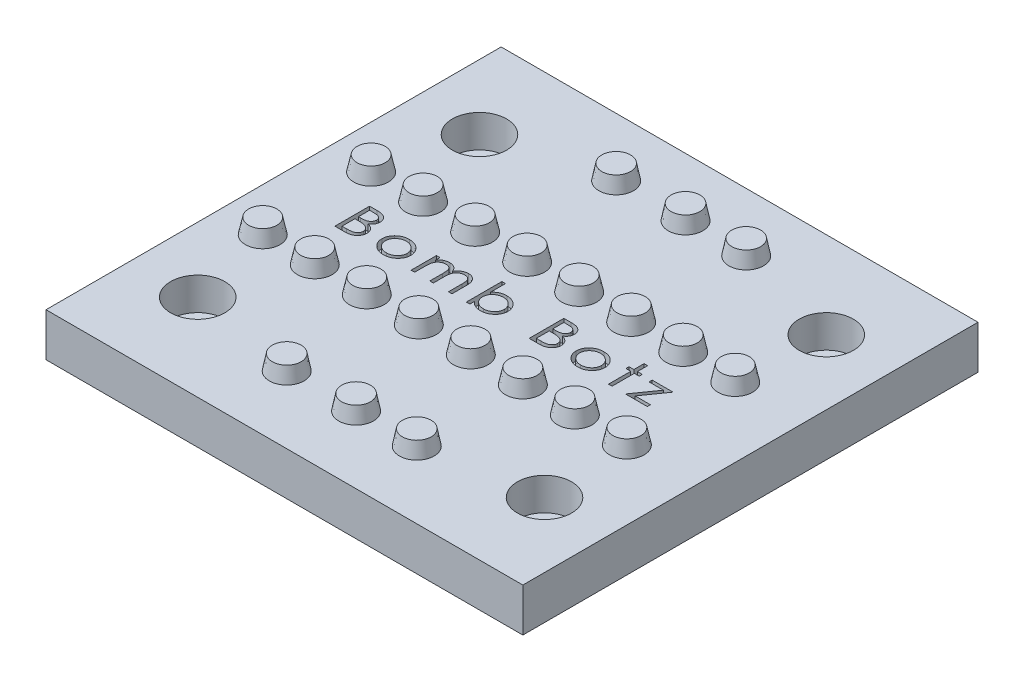
from build123d import *

# Parameters (mm, degrees)
SKETCH3_W                     = 69.85
SKETCH3_H                     = 66.675
BOSS_EXTRUDE2_DEPTH           = 6.35
SKETCH5_R                     = 3.96875
CUT_EXTRUDE1_DEPTH            = 4.7625
SKETCH6_R                     = 2.54
CUT_EXTRUDE2_DEPTH            = 71.380467635
SKETCH7_R                     = 2.54
BOSS_EXTRUDE3_DEPTH           = 2.2225
BOSS_EXTRUDE3_DRAFT           = 12
BOSS_EXTRUDE3_PROFILE_2_DEPTH = 2.2225
BOSS_EXTRUDE3_PROFILE_2_DRAFT = 12
LPATTERN1_COPY_1_SKETCH_R     = 2.54
LPATTERN1_COPY_1_DEPTH        = 2.2225
LPATTERN1_COPY_1_DRAFT        = 12
LPATTERN1_COPY_2_SKETCH_R     = 2.54
LPATTERN1_COPY_2_DEPTH        = 2.2225
LPATTERN1_COPY_2_DRAFT        = 12
LPATTERN1_COPY_3_SKETCH_R     = 2.54
LPATTERN1_COPY_3_DEPTH        = 2.2225
LPATTERN1_COPY_3_DRAFT        = 12
LPATTERN1_COPY_4_SKETCH_R     = 2.54
LPATTERN1_COPY_4_DEPTH        = 2.2225
LPATTERN1_COPY_4_DRAFT        = 12
LPATTERN1_COPY_5_SKETCH_R     = 2.54
LPATTERN1_COPY_5_DEPTH        = 2.2225
LPATTERN1_COPY_5_DRAFT        = 12
LPATTERN1_COPY_6_SKETCH_R     = 2.54
LPATTERN1_COPY_6_DEPTH        = 2.2225
LPATTERN1_COPY_6_DRAFT        = 12
LPATTERN1_COPY_7_SKETCH_R     = 2.54
LPATTERN1_COPY_7_DEPTH        = 2.2225
LPATTERN1_COPY_7_DRAFT        = 12
LPATTERN1_COPY_8_SKETCH_R     = 2.54
LPATTERN1_COPY_8_DEPTH        = 2.2225
LPATTERN1_COPY_8_DRAFT        = 12
LPATTERN1_COPY_9_SKETCH_R     = 2.54
LPATTERN1_COPY_9_DEPTH        = 2.2225
LPATTERN1_COPY_9_DRAFT        = 12
LPATTERN1_COPY_10_SKETCH_R    = 2.54
LPATTERN1_COPY_10_DEPTH       = 2.2225
LPATTERN1_COPY_10_DRAFT       = 12
LPATTERN1_COPY_11_SKETCH_R    = 2.54
LPATTERN1_COPY_11_DEPTH       = 2.2225
LPATTERN1_COPY_11_DRAFT       = 12
LPATTERN1_COPY_12_SKETCH_R    = 2.54
LPATTERN1_COPY_12_DEPTH       = 2.2225
LPATTERN1_COPY_12_DRAFT       = 12
LPATTERN1_COPY_13_SKETCH_R    = 2.54
LPATTERN1_COPY_13_DEPTH       = 2.2225
LPATTERN1_COPY_13_DRAFT       = 12
LPATTERN1_COPY_14_SKETCH_R    = 2.54
LPATTERN1_COPY_14_DEPTH       = 2.2225
LPATTERN1_COPY_14_DRAFT       = 12
LPATTERN1_COPY_15_SKETCH_R    = 2.54
LPATTERN1_COPY_15_DEPTH       = 2.2225
LPATTERN1_COPY_15_DRAFT       = 12
LPATTERN1_COPY_16_SKETCH_R    = 2.54
LPATTERN1_COPY_16_DEPTH       = 2.2225
LPATTERN1_COPY_16_DRAFT       = 12
LPATTERN1_COPY_17_SKETCH_R    = 2.54
LPATTERN1_COPY_17_DEPTH       = 2.2225
LPATTERN1_COPY_17_DRAFT       = 12
LPATTERN1_COPY_18_SKETCH_R    = 2.54
LPATTERN1_COPY_18_DEPTH       = 2.2225
LPATTERN1_COPY_18_DRAFT       = 12
LPATTERN1_COPY_19_SKETCH_R    = 2.54
LPATTERN1_COPY_19_DEPTH       = 2.2225
LPATTERN1_COPY_19_DRAFT       = 12
LPATTERN1_COPY_20_SKETCH_R    = 2.54
LPATTERN1_COPY_20_DEPTH       = 2.2225
LPATTERN1_COPY_20_DRAFT       = 12
LPATTERN1_COPY_21_SKETCH_R    = 2.54
LPATTERN1_COPY_21_DEPTH       = 2.2225
LPATTERN1_COPY_21_DRAFT       = 12
SKETCH8_R                     = 2.54
BOSS_EXTRUDE4_DEPTH           = 2.2225
BOSS_EXTRUDE4_DRAFT           = 11
BOSS_EXTRUDE4_PROFILE_2_DEPTH = 2.2225
BOSS_EXTRUDE4_PROFILE_2_DRAFT = 11
BOSS_EXTRUDE4_PROFILE_3_DEPTH = 2.2225
BOSS_EXTRUDE4_PROFILE_3_DRAFT = 11
LPATTERN2_COPY_1_SKETCH_R     = 2.54
LPATTERN2_COPY_1_DEPTH        = 2.2225
LPATTERN2_COPY_1_DRAFT        = 11
LPATTERN2_COPY_2_SKETCH_R     = 2.54
LPATTERN2_COPY_2_DEPTH        = 2.2225
LPATTERN2_COPY_2_DRAFT        = 11
LPATTERN2_COPY_3_SKETCH_R     = 2.54
LPATTERN2_COPY_3_DEPTH        = 2.2225
LPATTERN2_COPY_3_DRAFT        = 11
LPATTERN2_COPY_4_SKETCH_R     = 2.54
LPATTERN2_COPY_4_DEPTH        = 2.2225
LPATTERN2_COPY_4_DRAFT        = 11
LPATTERN2_COPY_5_SKETCH_R     = 2.54
LPATTERN2_COPY_5_DEPTH        = 2.2225
LPATTERN2_COPY_5_DRAFT        = 11
CUT_EXTRUDE3_DEPTH            = 1.27


with BuildPart() as part:
    # Sketch3 → Boss-Extrude2 (new body)
    with BuildSketch(Plane(origin=(0, 0, 0), x_dir=(1, 0, 0), z_dir=(0, 1, 0))):
        with Locations((12.715412621, -18.248543689)):
            Rectangle(SKETCH3_W, SKETCH3_H)
    extrude(amount=BOSS_EXTRUDE2_DEPTH)

    # Sketch5 → Cut-Extrude1 (cut)
    with BuildSketch(Plane(origin=(0, 6.35, 0), x_dir=(1, 0, 0), z_dir=(0, 1, 0))):
        with Locations(Location((-12.684587379, 2.388956311, 0), (0, 0, 270))):
            Circle(SKETCH5_R)
        with Locations(Location((38.115412621, 2.388956311, 0), (0, 0, 270))):
            Circle(SKETCH5_R)
        with Locations(Location((-12.684587379, -38.886043689, 0), (0, 0, 270))):
            Circle(SKETCH5_R)
        with Locations(Location((38.115412621, -38.886043689, 0), (0, 0, 270))):
            Circle(SKETCH5_R)
    extrude(amount=-CUT_EXTRUDE1_DEPTH, mode=Mode.SUBTRACT)

    # Sketch6 → Cut-Extrude2 (cut, through all)
    with BuildSketch(Plane(origin=(0, 1.5875, 0), x_dir=(1, 0, 0), z_dir=(0, 1, 0))):
        with Locations(Location((-12.684587379, 2.388956311, 0), (0, 0, 270))):
            Circle(SKETCH6_R)
        with Locations(Location((38.115412621, 2.388956311, 0), (0, 0, 270))):
            Circle(SKETCH6_R)
        with Locations(Location((38.115412621, -38.886043689, 0), (0, 0, 270))):
            Circle(SKETCH6_R)
        with Locations(Location((-12.684587379, -38.886043689, 0), (0, 0, 270))):
            Circle(SKETCH6_R)
    extrude(amount=-CUT_EXTRUDE2_DEPTH, mode=Mode.SUBTRACT)


with BuildPart() as boss_extrude3_tool:
    # Sketch7 → Boss-Extrude3 (with draft: the straight prism first)
    with BuildSketch(Plane(origin=(0, 6.35, 0), x_dir=(1, 0, 0), z_dir=(0, 1, 0))):
        with Locations((-15.859587379, -26.186043689)):
            Circle(SKETCH7_R)
    extrude(amount=BOSS_EXTRUDE3_DEPTH)
    # Boss-Extrude3: the draft: its side faces are tilted about the plane it starts from
    boss_extrude3_sides = [boss_extrude3_tool.faces().sort_by_distance(p)[0] for p in [
        (-18.399587379, 7.46125, 26.186043689),
    ]]
    draft(boss_extrude3_sides, Plane(origin=(0, 6.35, 0), x_dir=(1, 0, 0), z_dir=(0, 1, 0)), BOSS_EXTRUDE3_DRAFT)


with BuildPart() as part_1:
    add(part.part)

    # Boss-Extrude3: add boss_extrude3_tool
    add(boss_extrude3_tool.part)


with BuildPart() as boss_extrude3_profile_2_tool:
    # Sketch7 → Boss-Extrude3 profile 2 (with draft: the straight prism first)
    with BuildSketch(Plane(origin=(0, 6.35, 0), x_dir=(1, 0, 0), z_dir=(0, 1, 0))):
        with Locations((-15.859587379, -10.311043689)):
            Circle(SKETCH7_R)
    extrude(amount=BOSS_EXTRUDE3_PROFILE_2_DEPTH)
    # Boss-Extrude3 profile 2: the draft: its side faces are tilted about the plane it starts from
    boss_extrude3_profile_2_sides = [boss_extrude3_profile_2_tool.faces().sort_by_distance(p)[0] for p in [
        (-18.399587379, 7.46125, 10.311043689),
    ]]
    draft(boss_extrude3_profile_2_sides, Plane(origin=(0, 6.35, 0), x_dir=(1, 0, 0), z_dir=(0, 1, 0)), BOSS_EXTRUDE3_PROFILE_2_DRAFT)


with BuildPart() as part_2:
    add(part_1.part)

    # Boss-Extrude3 profile 2: add boss_extrude3_profile_2_tool
    add(boss_extrude3_profile_2_tool.part)


with BuildPart() as lpattern1_copy_1_tool:
    # LPattern1 copy 1 sketch → LPattern1 copy 1 (with draft: the straight prism first)
    with BuildSketch(Plane(origin=(7.62, 6.35, 0), x_dir=(1, 0, 0), z_dir=(0, 1, 0))):
        with Locations((-15.859587379, -26.186043689)):
            Circle(LPATTERN1_COPY_1_SKETCH_R)
    extrude(amount=LPATTERN1_COPY_1_DEPTH)
    # LPattern1 copy 1: the draft: its side faces are tilted about the plane it starts from
    lpattern1_copy_1_sides = [lpattern1_copy_1_tool.faces().sort_by_distance(p)[0] for p in [
        (-10.779587379, 7.46125, 26.186043689),
    ]]
    draft(lpattern1_copy_1_sides, Plane(origin=(7.62, 6.35, 0), x_dir=(1, 0, 0), z_dir=(0, 1, 0)), LPATTERN1_COPY_1_DRAFT)


with BuildPart() as part_3:
    add(part_2.part)

    # LPattern1 copy 1: add lpattern1_copy_1_tool
    add(lpattern1_copy_1_tool.part)


with BuildPart() as lpattern1_copy_2_tool:
    # LPattern1 copy 2 sketch → LPattern1 copy 2 (with draft: the straight prism first)
    with BuildSketch(Plane(origin=(15.24, 6.35, 0), x_dir=(1, 0, 0), z_dir=(0, 1, 0))):
        with Locations((-15.859587379, -26.186043689)):
            Circle(LPATTERN1_COPY_2_SKETCH_R)
    extrude(amount=LPATTERN1_COPY_2_DEPTH)
    # LPattern1 copy 2: the draft: its side faces are tilted about the plane it starts from
    lpattern1_copy_2_sides = [lpattern1_copy_2_tool.faces().sort_by_distance(p)[0] for p in [
        (-3.159587379, 7.46125, 26.186043689),
    ]]
    draft(lpattern1_copy_2_sides, Plane(origin=(15.24, 6.35, 0), x_dir=(1, 0, 0), z_dir=(0, 1, 0)), LPATTERN1_COPY_2_DRAFT)


with BuildPart() as part_4:
    add(part_3.part)

    # LPattern1 copy 2: add lpattern1_copy_2_tool
    add(lpattern1_copy_2_tool.part)


with BuildPart() as lpattern1_copy_3_tool:
    # LPattern1 copy 3 sketch → LPattern1 copy 3 (with draft: the straight prism first)
    with BuildSketch(Plane(origin=(22.86, 6.35, 0), x_dir=(1, 0, 0), z_dir=(0, 1, 0))):
        with Locations((-15.859587379, -26.186043689)):
            Circle(LPATTERN1_COPY_3_SKETCH_R)
    extrude(amount=LPATTERN1_COPY_3_DEPTH)
    # LPattern1 copy 3: the draft: its side faces are tilted about the plane it starts from
    lpattern1_copy_3_sides = [lpattern1_copy_3_tool.faces().sort_by_distance(p)[0] for p in [
        (4.460412621, 7.46125, 26.186043689),
    ]]
    draft(lpattern1_copy_3_sides, Plane(origin=(22.86, 6.35, 0), x_dir=(1, 0, 0), z_dir=(0, 1, 0)), LPATTERN1_COPY_3_DRAFT)


with BuildPart() as part_5:
    add(part_4.part)

    # LPattern1 copy 3: add lpattern1_copy_3_tool
    add(lpattern1_copy_3_tool.part)


with BuildPart() as lpattern1_copy_4_tool:
    # LPattern1 copy 4 sketch → LPattern1 copy 4 (with draft: the straight prism first)
    with BuildSketch(Plane(origin=(30.48, 6.35, 0), x_dir=(1, 0, 0), z_dir=(0, 1, 0))):
        with Locations((-15.859587379, -26.186043689)):
            Circle(LPATTERN1_COPY_4_SKETCH_R)
    extrude(amount=LPATTERN1_COPY_4_DEPTH)
    # LPattern1 copy 4: the draft: its side faces are tilted about the plane it starts from
    lpattern1_copy_4_sides = [lpattern1_copy_4_tool.faces().sort_by_distance(p)[0] for p in [
        (12.080412621, 7.46125, 26.186043689),
    ]]
    draft(lpattern1_copy_4_sides, Plane(origin=(30.48, 6.35, 0), x_dir=(1, 0, 0), z_dir=(0, 1, 0)), LPATTERN1_COPY_4_DRAFT)


with BuildPart() as part_6:
    add(part_5.part)

    # LPattern1 copy 4: add lpattern1_copy_4_tool
    add(lpattern1_copy_4_tool.part)


with BuildPart() as lpattern1_copy_5_tool:
    # LPattern1 copy 5 sketch → LPattern1 copy 5 (with draft: the straight prism first)
    with BuildSketch(Plane(origin=(38.1, 6.35, 0), x_dir=(1, 0, 0), z_dir=(0, 1, 0))):
        with Locations((-15.859587379, -26.186043689)):
            Circle(LPATTERN1_COPY_5_SKETCH_R)
    extrude(amount=LPATTERN1_COPY_5_DEPTH)
    # LPattern1 copy 5: the draft: its side faces are tilted about the plane it starts from
    lpattern1_copy_5_sides = [lpattern1_copy_5_tool.faces().sort_by_distance(p)[0] for p in [
        (19.700412621, 7.46125, 26.186043689),
    ]]
    draft(lpattern1_copy_5_sides, Plane(origin=(38.1, 6.35, 0), x_dir=(1, 0, 0), z_dir=(0, 1, 0)), LPATTERN1_COPY_5_DRAFT)


with BuildPart() as part_7:
    add(part_6.part)

    # LPattern1 copy 5: add lpattern1_copy_5_tool
    add(lpattern1_copy_5_tool.part)


with BuildPart() as lpattern1_copy_6_tool:
    # LPattern1 copy 6 sketch → LPattern1 copy 6 (with draft: the straight prism first)
    with BuildSketch(Plane(origin=(45.72, 6.35, 0), x_dir=(1, 0, 0), z_dir=(0, 1, 0))):
        with Locations((-15.859587379, -26.186043689)):
            Circle(LPATTERN1_COPY_6_SKETCH_R)
    extrude(amount=LPATTERN1_COPY_6_DEPTH)
    # LPattern1 copy 6: the draft: its side faces are tilted about the plane it starts from
    lpattern1_copy_6_sides = [lpattern1_copy_6_tool.faces().sort_by_distance(p)[0] for p in [
        (27.320412621, 7.46125, 26.186043689),
    ]]
    draft(lpattern1_copy_6_sides, Plane(origin=(45.72, 6.35, 0), x_dir=(1, 0, 0), z_dir=(0, 1, 0)), LPATTERN1_COPY_6_DRAFT)


with BuildPart() as part_8:
    add(part_7.part)

    # LPattern1 copy 6: add lpattern1_copy_6_tool
    add(lpattern1_copy_6_tool.part)


with BuildPart() as lpattern1_copy_7_tool:
    # LPattern1 copy 7 sketch → LPattern1 copy 7 (with draft: the straight prism first)
    with BuildSketch(Plane(origin=(53.34, 6.35, 0), x_dir=(1, 0, 0), z_dir=(0, 1, 0))):
        with Locations((-15.859587379, -26.186043689)):
            Circle(LPATTERN1_COPY_7_SKETCH_R)
    extrude(amount=LPATTERN1_COPY_7_DEPTH)
    # LPattern1 copy 7: the draft: its side faces are tilted about the plane it starts from
    lpattern1_copy_7_sides = [lpattern1_copy_7_tool.faces().sort_by_distance(p)[0] for p in [
        (34.940412621, 7.46125, 26.186043689),
    ]]
    draft(lpattern1_copy_7_sides, Plane(origin=(53.34, 6.35, 0), x_dir=(1, 0, 0), z_dir=(0, 1, 0)), LPATTERN1_COPY_7_DRAFT)


with BuildPart() as part_9:
    add(part_8.part)

    # LPattern1 copy 7: add lpattern1_copy_7_tool
    add(lpattern1_copy_7_tool.part)


with BuildPart() as lpattern1_copy_8_tool:
    # LPattern1 copy 8 sketch → LPattern1 copy 8 (with draft: the straight prism first)
    with BuildSketch(Plane(origin=(7.62, 6.35, 0), x_dir=(1, 0, 0), z_dir=(0, 1, 0))):
        with Locations((-15.859587379, -10.311043689)):
            Circle(LPATTERN1_COPY_8_SKETCH_R)
    extrude(amount=LPATTERN1_COPY_8_DEPTH)
    # LPattern1 copy 8: the draft: its side faces are tilted about the plane it starts from
    lpattern1_copy_8_sides = [lpattern1_copy_8_tool.faces().sort_by_distance(p)[0] for p in [
        (-10.779587379, 7.46125, 10.311043689),
    ]]
    draft(lpattern1_copy_8_sides, Plane(origin=(7.62, 6.35, 0), x_dir=(1, 0, 0), z_dir=(0, 1, 0)), LPATTERN1_COPY_8_DRAFT)


with BuildPart() as part_10:
    add(part_9.part)

    # LPattern1 copy 8: add lpattern1_copy_8_tool
    add(lpattern1_copy_8_tool.part)


with BuildPart() as lpattern1_copy_9_tool:
    # LPattern1 copy 9 sketch → LPattern1 copy 9 (with draft: the straight prism first)
    with BuildSketch(Plane(origin=(15.24, 6.35, 0), x_dir=(1, 0, 0), z_dir=(0, 1, 0))):
        with Locations((-15.859587379, -10.311043689)):
            Circle(LPATTERN1_COPY_9_SKETCH_R)
    extrude(amount=LPATTERN1_COPY_9_DEPTH)
    # LPattern1 copy 9: the draft: its side faces are tilted about the plane it starts from
    lpattern1_copy_9_sides = [lpattern1_copy_9_tool.faces().sort_by_distance(p)[0] for p in [
        (-3.159587379, 7.46125, 10.311043689),
    ]]
    draft(lpattern1_copy_9_sides, Plane(origin=(15.24, 6.35, 0), x_dir=(1, 0, 0), z_dir=(0, 1, 0)), LPATTERN1_COPY_9_DRAFT)


with BuildPart() as part_11:
    add(part_10.part)

    # LPattern1 copy 9: add lpattern1_copy_9_tool
    add(lpattern1_copy_9_tool.part)


with BuildPart() as lpattern1_copy_10_tool:
    # LPattern1 copy 10 sketch → LPattern1 copy 10 (with draft: the straight prism first)
    with BuildSketch(Plane(origin=(22.86, 6.35, 0), x_dir=(1, 0, 0), z_dir=(0, 1, 0))):
        with Locations((-15.859587379, -10.311043689)):
            Circle(LPATTERN1_COPY_10_SKETCH_R)
    extrude(amount=LPATTERN1_COPY_10_DEPTH)
    # LPattern1 copy 10: the draft: its side faces are tilted about the plane it starts from
    lpattern1_copy_10_sides = [lpattern1_copy_10_tool.faces().sort_by_distance(p)[0] for p in [
        (4.460412621, 7.46125, 10.311043689),
    ]]
    draft(lpattern1_copy_10_sides, Plane(origin=(22.86, 6.35, 0), x_dir=(1, 0, 0), z_dir=(0, 1, 0)), LPATTERN1_COPY_10_DRAFT)


with BuildPart() as part_12:
    add(part_11.part)

    # LPattern1 copy 10: add lpattern1_copy_10_tool
    add(lpattern1_copy_10_tool.part)


with BuildPart() as lpattern1_copy_11_tool:
    # LPattern1 copy 11 sketch → LPattern1 copy 11 (with draft: the straight prism first)
    with BuildSketch(Plane(origin=(30.48, 6.35, 0), x_dir=(1, 0, 0), z_dir=(0, 1, 0))):
        with Locations((-15.859587379, -10.311043689)):
            Circle(LPATTERN1_COPY_11_SKETCH_R)
    extrude(amount=LPATTERN1_COPY_11_DEPTH)
    # LPattern1 copy 11: the draft: its side faces are tilted about the plane it starts from
    lpattern1_copy_11_sides = [lpattern1_copy_11_tool.faces().sort_by_distance(p)[0] for p in [
        (12.080412621, 7.46125, 10.311043689),
    ]]
    draft(lpattern1_copy_11_sides, Plane(origin=(30.48, 6.35, 0), x_dir=(1, 0, 0), z_dir=(0, 1, 0)), LPATTERN1_COPY_11_DRAFT)


with BuildPart() as part_13:
    add(part_12.part)

    # LPattern1 copy 11: add lpattern1_copy_11_tool
    add(lpattern1_copy_11_tool.part)


with BuildPart() as lpattern1_copy_12_tool:
    # LPattern1 copy 12 sketch → LPattern1 copy 12 (with draft: the straight prism first)
    with BuildSketch(Plane(origin=(38.1, 6.35, 0), x_dir=(1, 0, 0), z_dir=(0, 1, 0))):
        with Locations((-15.859587379, -10.311043689)):
            Circle(LPATTERN1_COPY_12_SKETCH_R)
    extrude(amount=LPATTERN1_COPY_12_DEPTH)
    # LPattern1 copy 12: the draft: its side faces are tilted about the plane it starts from
    lpattern1_copy_12_sides = [lpattern1_copy_12_tool.faces().sort_by_distance(p)[0] for p in [
        (19.700412621, 7.46125, 10.311043689),
    ]]
    draft(lpattern1_copy_12_sides, Plane(origin=(38.1, 6.35, 0), x_dir=(1, 0, 0), z_dir=(0, 1, 0)), LPATTERN1_COPY_12_DRAFT)


with BuildPart() as part_14:
    add(part_13.part)

    # LPattern1 copy 12: add lpattern1_copy_12_tool
    add(lpattern1_copy_12_tool.part)


with BuildPart() as lpattern1_copy_13_tool:
    # LPattern1 copy 13 sketch → LPattern1 copy 13 (with draft: the straight prism first)
    with BuildSketch(Plane(origin=(45.72, 6.35, 0), x_dir=(1, 0, 0), z_dir=(0, 1, 0))):
        with Locations((-15.859587379, -10.311043689)):
            Circle(LPATTERN1_COPY_13_SKETCH_R)
    extrude(amount=LPATTERN1_COPY_13_DEPTH)
    # LPattern1 copy 13: the draft: its side faces are tilted about the plane it starts from
    lpattern1_copy_13_sides = [lpattern1_copy_13_tool.faces().sort_by_distance(p)[0] for p in [
        (27.320412621, 7.46125, 10.311043689),
    ]]
    draft(lpattern1_copy_13_sides, Plane(origin=(45.72, 6.35, 0), x_dir=(1, 0, 0), z_dir=(0, 1, 0)), LPATTERN1_COPY_13_DRAFT)


with BuildPart() as part_15:
    add(part_14.part)

    # LPattern1 copy 13: add lpattern1_copy_13_tool
    add(lpattern1_copy_13_tool.part)


with BuildPart() as lpattern1_copy_14_tool:
    # LPattern1 copy 14 sketch → LPattern1 copy 14 (with draft: the straight prism first)
    with BuildSketch(Plane(origin=(53.34, 6.35, 0), x_dir=(1, 0, 0), z_dir=(0, 1, 0))):
        with Locations((-15.859587379, -10.311043689)):
            Circle(LPATTERN1_COPY_14_SKETCH_R)
    extrude(amount=LPATTERN1_COPY_14_DEPTH)
    # LPattern1 copy 14: the draft: its side faces are tilted about the plane it starts from
    lpattern1_copy_14_sides = [lpattern1_copy_14_tool.faces().sort_by_distance(p)[0] for p in [
        (34.940412621, 7.46125, 10.311043689),
    ]]
    draft(lpattern1_copy_14_sides, Plane(origin=(53.34, 6.35, 0), x_dir=(1, 0, 0), z_dir=(0, 1, 0)), LPATTERN1_COPY_14_DRAFT)


with BuildPart() as part_16:
    add(part_15.part)

    # LPattern1 copy 14: add lpattern1_copy_14_tool
    add(lpattern1_copy_14_tool.part)


with BuildPart() as lpattern1_copy_15_tool:
    # LPattern1 copy 15 sketch → LPattern1 copy 15 (with draft: the straight prism first)
    with BuildSketch(Plane(origin=(7.62, 6.35, 0), x_dir=(1, 0, 0), z_dir=(0, 1, 0))):
        with Locations((-15.859587379, -10.311043689)):
            Circle(LPATTERN1_COPY_15_SKETCH_R)
    extrude(amount=LPATTERN1_COPY_15_DEPTH)
    # LPattern1 copy 15: the draft: its side faces are tilted about the plane it starts from
    lpattern1_copy_15_sides = [lpattern1_copy_15_tool.faces().sort_by_distance(p)[0] for p in [
        (-10.779587379, 7.46125, 10.311043689),
    ]]
    draft(lpattern1_copy_15_sides, Plane(origin=(7.62, 6.35, 0), x_dir=(1, 0, 0), z_dir=(0, 1, 0)), LPATTERN1_COPY_15_DRAFT)


with BuildPart() as part_17:
    add(part_16.part)

    # LPattern1 copy 15: add lpattern1_copy_15_tool
    add(lpattern1_copy_15_tool.part)


with BuildPart() as lpattern1_copy_16_tool:
    # LPattern1 copy 16 sketch → LPattern1 copy 16 (with draft: the straight prism first)
    with BuildSketch(Plane(origin=(15.24, 6.35, 0), x_dir=(1, 0, 0), z_dir=(0, 1, 0))):
        with Locations((-15.859587379, -10.311043689)):
            Circle(LPATTERN1_COPY_16_SKETCH_R)
    extrude(amount=LPATTERN1_COPY_16_DEPTH)
    # LPattern1 copy 16: the draft: its side faces are tilted about the plane it starts from
    lpattern1_copy_16_sides = [lpattern1_copy_16_tool.faces().sort_by_distance(p)[0] for p in [
        (-3.159587379, 7.46125, 10.311043689),
    ]]
    draft(lpattern1_copy_16_sides, Plane(origin=(15.24, 6.35, 0), x_dir=(1, 0, 0), z_dir=(0, 1, 0)), LPATTERN1_COPY_16_DRAFT)


with BuildPart() as part_18:
    add(part_17.part)

    # LPattern1 copy 16: add lpattern1_copy_16_tool
    add(lpattern1_copy_16_tool.part)


with BuildPart() as lpattern1_copy_17_tool:
    # LPattern1 copy 17 sketch → LPattern1 copy 17 (with draft: the straight prism first)
    with BuildSketch(Plane(origin=(22.86, 6.35, 0), x_dir=(1, 0, 0), z_dir=(0, 1, 0))):
        with Locations((-15.859587379, -10.311043689)):
            Circle(LPATTERN1_COPY_17_SKETCH_R)
    extrude(amount=LPATTERN1_COPY_17_DEPTH)
    # LPattern1 copy 17: the draft: its side faces are tilted about the plane it starts from
    lpattern1_copy_17_sides = [lpattern1_copy_17_tool.faces().sort_by_distance(p)[0] for p in [
        (4.460412621, 7.46125, 10.311043689),
    ]]
    draft(lpattern1_copy_17_sides, Plane(origin=(22.86, 6.35, 0), x_dir=(1, 0, 0), z_dir=(0, 1, 0)), LPATTERN1_COPY_17_DRAFT)


with BuildPart() as part_19:
    add(part_18.part)

    # LPattern1 copy 17: add lpattern1_copy_17_tool
    add(lpattern1_copy_17_tool.part)


with BuildPart() as lpattern1_copy_18_tool:
    # LPattern1 copy 18 sketch → LPattern1 copy 18 (with draft: the straight prism first)
    with BuildSketch(Plane(origin=(30.48, 6.35, 0), x_dir=(1, 0, 0), z_dir=(0, 1, 0))):
        with Locations((-15.859587379, -10.311043689)):
            Circle(LPATTERN1_COPY_18_SKETCH_R)
    extrude(amount=LPATTERN1_COPY_18_DEPTH)
    # LPattern1 copy 18: the draft: its side faces are tilted about the plane it starts from
    lpattern1_copy_18_sides = [lpattern1_copy_18_tool.faces().sort_by_distance(p)[0] for p in [
        (12.080412621, 7.46125, 10.311043689),
    ]]
    draft(lpattern1_copy_18_sides, Plane(origin=(30.48, 6.35, 0), x_dir=(1, 0, 0), z_dir=(0, 1, 0)), LPATTERN1_COPY_18_DRAFT)


with BuildPart() as part_20:
    add(part_19.part)

    # LPattern1 copy 18: add lpattern1_copy_18_tool
    add(lpattern1_copy_18_tool.part)


with BuildPart() as lpattern1_copy_19_tool:
    # LPattern1 copy 19 sketch → LPattern1 copy 19 (with draft: the straight prism first)
    with BuildSketch(Plane(origin=(38.1, 6.35, 0), x_dir=(1, 0, 0), z_dir=(0, 1, 0))):
        with Locations((-15.859587379, -10.311043689)):
            Circle(LPATTERN1_COPY_19_SKETCH_R)
    extrude(amount=LPATTERN1_COPY_19_DEPTH)
    # LPattern1 copy 19: the draft: its side faces are tilted about the plane it starts from
    lpattern1_copy_19_sides = [lpattern1_copy_19_tool.faces().sort_by_distance(p)[0] for p in [
        (19.700412621, 7.46125, 10.311043689),
    ]]
    draft(lpattern1_copy_19_sides, Plane(origin=(38.1, 6.35, 0), x_dir=(1, 0, 0), z_dir=(0, 1, 0)), LPATTERN1_COPY_19_DRAFT)


with BuildPart() as part_21:
    add(part_20.part)

    # LPattern1 copy 19: add lpattern1_copy_19_tool
    add(lpattern1_copy_19_tool.part)


with BuildPart() as lpattern1_copy_20_tool:
    # LPattern1 copy 20 sketch → LPattern1 copy 20 (with draft: the straight prism first)
    with BuildSketch(Plane(origin=(45.72, 6.35, 0), x_dir=(1, 0, 0), z_dir=(0, 1, 0))):
        with Locations((-15.859587379, -10.311043689)):
            Circle(LPATTERN1_COPY_20_SKETCH_R)
    extrude(amount=LPATTERN1_COPY_20_DEPTH)
    # LPattern1 copy 20: the draft: its side faces are tilted about the plane it starts from
    lpattern1_copy_20_sides = [lpattern1_copy_20_tool.faces().sort_by_distance(p)[0] for p in [
        (27.320412621, 7.46125, 10.311043689),
    ]]
    draft(lpattern1_copy_20_sides, Plane(origin=(45.72, 6.35, 0), x_dir=(1, 0, 0), z_dir=(0, 1, 0)), LPATTERN1_COPY_20_DRAFT)


with BuildPart() as part_22:
    add(part_21.part)

    # LPattern1 copy 20: add lpattern1_copy_20_tool
    add(lpattern1_copy_20_tool.part)


with BuildPart() as lpattern1_copy_21_tool:
    # LPattern1 copy 21 sketch → LPattern1 copy 21 (with draft: the straight prism first)
    with BuildSketch(Plane(origin=(53.34, 6.35, 0), x_dir=(1, 0, 0), z_dir=(0, 1, 0))):
        with Locations((-15.859587379, -10.311043689)):
            Circle(LPATTERN1_COPY_21_SKETCH_R)
    extrude(amount=LPATTERN1_COPY_21_DEPTH)
    # LPattern1 copy 21: the draft: its side faces are tilted about the plane it starts from
    lpattern1_copy_21_sides = [lpattern1_copy_21_tool.faces().sort_by_distance(p)[0] for p in [
        (34.940412621, 7.46125, 10.311043689),
    ]]
    draft(lpattern1_copy_21_sides, Plane(origin=(53.34, 6.35, 0), x_dir=(1, 0, 0), z_dir=(0, 1, 0)), LPATTERN1_COPY_21_DRAFT)


with BuildPart() as part_23:
    add(part_22.part)

    # LPattern1 copy 21: add lpattern1_copy_21_tool
    add(lpattern1_copy_21_tool.part)


with BuildPart() as boss_extrude4_tool:
    # Sketch8 → Boss-Extrude4 (with draft: the straight prism first)
    with BuildSketch(Plane(origin=(0, 6.35, 0), x_dir=(1, 0, 0), z_dir=(0, 1, 0))):
        with Locations((3.190412621, -41.7236688)):
            Circle(SKETCH8_R)
    extrude(amount=BOSS_EXTRUDE4_DEPTH)
    # Boss-Extrude4: the draft: its side faces are tilted about the plane it starts from
    boss_extrude4_sides = [boss_extrude4_tool.faces().sort_by_distance(p)[0] for p in [
        (0.650412621, 7.46125, 41.7236688),
    ]]
    draft(boss_extrude4_sides, Plane(origin=(0, 6.35, 0), x_dir=(1, 0, 0), z_dir=(0, 1, 0)), BOSS_EXTRUDE4_DRAFT)


with BuildPart() as part_24:
    add(part_23.part)

    # Boss-Extrude4: add boss_extrude4_tool
    add(boss_extrude4_tool.part)


with BuildPart() as boss_extrude4_profile_2_tool:
    # Sketch8 → Boss-Extrude4 profile 2 (with draft: the straight prism first)
    with BuildSketch(Plane(origin=(0, 6.35, 0), x_dir=(1, 0, 0), z_dir=(0, 1, 0))):
        with Locations((22.240412621, -41.7236688)):
            Circle(SKETCH8_R)
    extrude(amount=BOSS_EXTRUDE4_PROFILE_2_DEPTH)
    # Boss-Extrude4 profile 2: the draft: its side faces are tilted about the plane it starts from
    boss_extrude4_profile_2_sides = [boss_extrude4_profile_2_tool.faces().sort_by_distance(p)[0] for p in [
        (19.700412621, 7.46125, 41.7236688),
    ]]
    draft(boss_extrude4_profile_2_sides, Plane(origin=(0, 6.35, 0), x_dir=(1, 0, 0), z_dir=(0, 1, 0)), BOSS_EXTRUDE4_PROFILE_2_DRAFT)


with BuildPart() as part_25:
    add(part_24.part)

    # Boss-Extrude4 profile 2: add boss_extrude4_profile_2_tool
    add(boss_extrude4_profile_2_tool.part)


with BuildPart() as boss_extrude4_profile_3_tool:
    # Sketch8 → Boss-Extrude4 profile 3 (with draft: the straight prism first)
    with BuildSketch(Plane(origin=(0, 6.35, 0), x_dir=(1, 0, 0), z_dir=(0, 1, 0))):
        with Locations((13.350412621, -41.7236688)):
            Circle(SKETCH8_R)
    extrude(amount=BOSS_EXTRUDE4_PROFILE_3_DEPTH)
    # Boss-Extrude4 profile 3: the draft: its side faces are tilted about the plane it starts from
    boss_extrude4_profile_3_sides = [boss_extrude4_profile_3_tool.faces().sort_by_distance(p)[0] for p in [
        (10.810412621, 7.46125, 41.7236688),
    ]]
    draft(boss_extrude4_profile_3_sides, Plane(origin=(0, 6.35, 0), x_dir=(1, 0, 0), z_dir=(0, 1, 0)), BOSS_EXTRUDE4_PROFILE_3_DRAFT)


with BuildPart() as part_26:
    add(part_25.part)

    # Boss-Extrude4 profile 3: add boss_extrude4_profile_3_tool
    add(boss_extrude4_profile_3_tool.part)


with BuildPart() as lpattern2_copy_1_tool:
    # LPattern2 copy 1 sketch → LPattern2 copy 1 (with draft: the straight prism first)
    with BuildSketch(Plane(origin=(0, 6.35, -48.26), x_dir=(1, 0, 0), z_dir=(0, 1, 0))):
        with Locations((3.190412621, -41.7236688)):
            Circle(LPATTERN2_COPY_1_SKETCH_R)
    extrude(amount=LPATTERN2_COPY_1_DEPTH)
    # LPattern2 copy 1: the draft: its side faces are tilted about the plane it starts from
    lpattern2_copy_1_sides = [lpattern2_copy_1_tool.faces().sort_by_distance(p)[0] for p in [
        (0.650412621, 7.46125, -6.5363312),
    ]]
    draft(lpattern2_copy_1_sides, Plane(origin=(0, 6.35, -48.26), x_dir=(1, 0, 0), z_dir=(0, 1, 0)), LPATTERN2_COPY_1_DRAFT)


with BuildPart() as part_27:
    add(part_26.part)

    # LPattern2 copy 1: add lpattern2_copy_1_tool
    add(lpattern2_copy_1_tool.part)


with BuildPart() as lpattern2_copy_2_tool:
    # LPattern2 copy 2 sketch → LPattern2 copy 2 (with draft: the straight prism first)
    with BuildSketch(Plane(origin=(0, 6.35, -48.26), x_dir=(1, 0, 0), z_dir=(0, 1, 0))):
        with Locations((22.240412621, -41.7236688)):
            Circle(LPATTERN2_COPY_2_SKETCH_R)
    extrude(amount=LPATTERN2_COPY_2_DEPTH)
    # LPattern2 copy 2: the draft: its side faces are tilted about the plane it starts from
    lpattern2_copy_2_sides = [lpattern2_copy_2_tool.faces().sort_by_distance(p)[0] for p in [
        (19.700412621, 7.46125, -6.5363312),
    ]]
    draft(lpattern2_copy_2_sides, Plane(origin=(0, 6.35, -48.26), x_dir=(1, 0, 0), z_dir=(0, 1, 0)), LPATTERN2_COPY_2_DRAFT)


with BuildPart() as part_28:
    add(part_27.part)

    # LPattern2 copy 2: add lpattern2_copy_2_tool
    add(lpattern2_copy_2_tool.part)


with BuildPart() as lpattern2_copy_3_tool:
    # LPattern2 copy 3 sketch → LPattern2 copy 3 (with draft: the straight prism first)
    with BuildSketch(Plane(origin=(0, 6.35, -48.26), x_dir=(1, 0, 0), z_dir=(0, 1, 0))):
        with Locations((13.350412621, -41.7236688)):
            Circle(LPATTERN2_COPY_3_SKETCH_R)
    extrude(amount=LPATTERN2_COPY_3_DEPTH)
    # LPattern2 copy 3: the draft: its side faces are tilted about the plane it starts from
    lpattern2_copy_3_sides = [lpattern2_copy_3_tool.faces().sort_by_distance(p)[0] for p in [
        (10.810412621, 7.46125, -6.5363312),
    ]]
    draft(lpattern2_copy_3_sides, Plane(origin=(0, 6.35, -48.26), x_dir=(1, 0, 0), z_dir=(0, 1, 0)), LPATTERN2_COPY_3_DRAFT)


with BuildPart() as part_29:
    add(part_28.part)

    # LPattern2 copy 3: add lpattern2_copy_3_tool
    add(lpattern2_copy_3_tool.part)


with BuildPart() as lpattern2_copy_4_tool:
    # LPattern2 copy 4 sketch → LPattern2 copy 4 (with draft: the straight prism first)
    with BuildSketch(Plane(origin=(0, 6.35, -48.26), x_dir=(1, 0, 0), z_dir=(0, 1, 0))):
        with Locations((22.240412621, -41.7236688)):
            Circle(LPATTERN2_COPY_4_SKETCH_R)
    extrude(amount=LPATTERN2_COPY_4_DEPTH)
    # LPattern2 copy 4: the draft: its side faces are tilted about the plane it starts from
    lpattern2_copy_4_sides = [lpattern2_copy_4_tool.faces().sort_by_distance(p)[0] for p in [
        (19.700412621, 7.46125, -6.5363312),
    ]]
    draft(lpattern2_copy_4_sides, Plane(origin=(0, 6.35, -48.26), x_dir=(1, 0, 0), z_dir=(0, 1, 0)), LPATTERN2_COPY_4_DRAFT)


with BuildPart() as part_30:
    add(part_29.part)

    # LPattern2 copy 4: add lpattern2_copy_4_tool
    add(lpattern2_copy_4_tool.part)


with BuildPart() as lpattern2_copy_5_tool:
    # LPattern2 copy 5 sketch → LPattern2 copy 5 (with draft: the straight prism first)
    with BuildSketch(Plane(origin=(0, 6.35, -48.26), x_dir=(1, 0, 0), z_dir=(0, 1, 0))):
        with Locations((13.350412621, -41.7236688)):
            Circle(LPATTERN2_COPY_5_SKETCH_R)
    extrude(amount=LPATTERN2_COPY_5_DEPTH)
    # LPattern2 copy 5: the draft: its side faces are tilted about the plane it starts from
    lpattern2_copy_5_sides = [lpattern2_copy_5_tool.faces().sort_by_distance(p)[0] for p in [
        (10.810412621, 7.46125, -6.5363312),
    ]]
    draft(lpattern2_copy_5_sides, Plane(origin=(0, 6.35, -48.26), x_dir=(1, 0, 0), z_dir=(0, 1, 0)), LPATTERN2_COPY_5_DRAFT)


with BuildPart() as part_31:
    add(part_30.part)

    # LPattern2 copy 5: add lpattern2_copy_5_tool
    add(lpattern2_copy_5_tool.part)

    # Sketch9 → Cut-Extrude3 (cut)
    # profile 1 of 8: a face of its own
    with BuildSketch(Plane(origin=(0, 6.35, 0), x_dir=(1, 0, 0), z_dir=(0, 1, 0))):
        with BuildLine():
            Line((-11.646612498, -14.748331511), (-10.581155768, -14.748331511))
            add(Edge.make_bspline(
                [(-10.581155768, -14.748331511), (-10.529246028, -14.748599262), (-10.428087699, -14.749121038), (-10.281156078, -14.756683676), (-10.143254695, -14.767250092), (-10.014973133, -14.783757259), (-9.89605769, -14.803741669), (-9.78623027, -14.828127296), (-9.685665032, -14.856986568), (-9.565715504, -14.903242283), (-9.42897011, -14.971615991), (-9.280640754, -15.073304435), (-9.152024665, -15.196363901), (-9.042999733, -15.337207175), (-8.955921868, -15.491275613), (-8.891421998, -15.655411137), (-8.852782853, -15.828614526), (-8.848341832, -15.947244479), (-8.846099678, -16.0071376)],
                knots=[0, 0, 0, 0, 1.026537215, 2.000449073, 2.909141399, 3.761240825, 4.557558307, 5.293237899, 5.98532028, 6.624491679, 7.833606506, 9.000439915, 10.167774665, 11.33928532, 12.510930433, 13.655860955, 14.816506274, 16, 16, 16, 16], degree=3))
            add(Edge.make_bspline(
                [(-8.846099678, -16.0071376), (-8.847872375, -16.063270857), (-8.851361237, -16.173747279), (-8.884531211, -16.33519541), (-8.936182238, -16.489175744), (-9.00974267, -16.634302798), (-9.104363455, -16.767930811), (-9.216934654, -16.890957096), (-9.351866026, -16.998047629), (-9.452192088, -17.057474545), (-9.503487498, -17.087858754)],
                knots=[0, 0, 0, 0, 1.010534172, 1.988842405, 2.957379883, 3.930671019, 4.909265711, 5.899930093, 6.926261555, 8, 8, 8, 8], degree=3))
            add(Edge.make_bspline(
                [(-9.503487498, -17.087858754), (-9.437999152, -17.109956203), (-9.31319391, -17.152068694), (-9.140742104, -17.227206357), (-8.991724214, -17.308279056), (-8.865098187, -17.396867547), (-8.757771724, -17.493701171), (-8.662435309, -17.59708636), (-8.581444024, -17.711299975), (-8.512905386, -17.834130251), (-8.457843843, -17.963590459), (-8.418941879, -18.099950991), (-8.395039598, -18.241345257), (-8.391823499, -18.3377527), (-8.390202242, -18.386352344)],
                knots=[0, 0, 0, 0, 1.346938803, 2.566945604, 3.662061121, 4.64912261, 5.571723393, 6.47516609, 7.385335965, 8.294183634, 9.212865765, 10.121208085, 11.052888294, 12, 12, 12, 12], degree=3))
            add(Edge.make_bspline(
                [(-8.390202242, -18.386352344), (-8.391445777, -18.435965357), (-8.393894991, -18.533681048), (-8.417043334, -18.677055523), (-8.454533242, -18.814405643), (-8.508306239, -18.945499568), (-8.575841171, -19.071533858), (-8.658291314, -19.192080322), (-8.757546224, -19.305045049), (-8.868352366, -19.413101894), (-8.993509293, -19.509667745), (-9.128153976, -19.596677643), (-9.274767929, -19.666962731), (-9.430359289, -19.726892259), (-9.596798278, -19.772350879), (-9.773553605, -19.804212906), (-9.960218301, -19.825626541), (-10.088222204, -19.827415619), (-10.153751922, -19.828331511)],
                knots=[0, 0, 0, 0, 0.934016837, 1.839600048, 2.727906891, 3.610749874, 4.502726475, 5.417305507, 6.355074482, 7.33122427, 8.328254086, 9.328044487, 10.345425603, 11.385019735, 12.465559397, 13.589787999, 14.766127372, 16, 16, 16, 16], degree=3))
            Line((-10.153751922, -19.828331511), (-11.646612498, -19.828331511))
            Line((-11.646612498, -19.828331511), (-11.646612498, -14.748331511))
        make_face()
        with BuildLine():
            Line((-11.125586857, -15.269357152), (-11.125586857, -16.89756228))
            Line((-11.125586857, -16.89756228), (-10.808086857, -16.89756228))
            add(Edge.make_bspline(
                [(-10.808086857, -16.89756228), (-10.761276839, -16.896981709), (-10.671032198, -16.895862431), (-10.540659777, -16.892669642), (-10.419954096, -16.883640463), (-10.308791542, -16.874638438), (-10.206984089, -16.860002558), (-10.115072839, -16.842687747), (-10.032029246, -16.824364443), (-9.936577576, -16.792692628), (-9.828085379, -16.746999518), (-9.712366484, -16.674846004), (-9.60999692, -16.589745218), (-9.523726264, -16.491022408), (-9.454021406, -16.382021477), (-9.403991775, -16.265521683), (-9.372887615, -16.142727006), (-9.369066143, -16.058879945), (-9.367125319, -16.016296254)],
                knots=[0, 0, 0, 0, 1.179326401, 2.273613436, 3.284231698, 4.228051849, 5.082418279, 5.87346064, 6.584387835, 7.222117952, 8.404721211, 9.540556389, 10.644476126, 11.746542315, 12.829864912, 13.890161551, 14.928469205, 16, 16, 16, 16], degree=3))
            add(Edge.make_bspline(
                [(-9.367125319, -16.016296254), (-9.367914016, -15.988107352), (-9.36946113, -15.932811743), (-9.381391793, -15.852008312), (-9.403589401, -15.776293179), (-9.431389579, -15.704242139), (-9.469713297, -15.637858356), (-9.516035101, -15.575866184), (-9.571207229, -15.51934777), (-9.633905289, -15.466625005), (-9.705794853, -15.419562989), (-9.787643178, -15.378625777), (-9.879959957, -15.346088418), (-9.981278183, -15.316604306), (-10.092946704, -15.2967995), (-10.214011832, -15.279614293), (-10.344944869, -15.27111314), (-10.435626371, -15.269955071), (-10.482445832, -15.269357152)],
                knots=[0, 0, 0, 0, 0.890650758, 1.74710872, 2.571581619, 3.379658413, 4.181312168, 4.985184098, 5.819009381, 6.671231587, 7.569012546, 8.527685762, 9.555133466, 10.657868142, 11.858173333, 13.134505503, 14.520526182, 16, 16, 16, 16], degree=3))
            Line((-10.482445832, -15.269357152), (-11.125586857, -15.269357152))
        make_face(mode=Mode.SUBTRACT)
        with BuildLine():
            Line((-11.125586857, -17.418587921), (-11.125586857, -19.30730587))
            Line((-11.125586857, -19.30730587), (-10.435634934, -19.30730587))
            add(Edge.make_bspline(
                [(-10.435634934, -19.30730587), (-10.386447833, -19.306751052), (-10.291450103, -19.305679502), (-10.153995144, -19.302127009), (-10.02665937, -19.294320224), (-9.909714333, -19.281468064), (-9.802854742, -19.268337364), (-9.706516088, -19.249542068), (-9.620071037, -19.228693034), (-9.519209058, -19.196584821), (-9.405785589, -19.146299059), (-9.283588588, -19.070111665), (-9.174245464, -18.980440805), (-9.082114823, -18.875348094), (-9.007278828, -18.761169247), (-8.950387692, -18.641172838), (-8.918237465, -18.51487266), (-8.913568125, -18.429260562), (-8.911227883, -18.386352344)],
                knots=[0, 0, 0, 0, 1.180159444, 2.279306238, 3.298669569, 4.239650532, 5.101729713, 5.880625065, 6.593175785, 7.234034421, 8.418143755, 9.558574576, 10.679765258, 11.798294531, 12.897561832, 13.946260739, 14.970679439, 16, 16, 16, 16], degree=3))
            add(Edge.make_bspline(
                [(-8.911227883, -18.386352344), (-8.912101516, -18.359523779), (-8.91383421, -18.306314164), (-8.924889719, -18.227736425), (-8.944862815, -18.151965599), (-8.970548664, -18.078468514), (-9.006574092, -18.00866507), (-9.047659747, -17.940171135), (-9.098086633, -17.875190312), (-9.175041303, -17.791418004), (-9.287843812, -17.696103025), (-9.44607032, -17.602019863), (-9.626797816, -17.527091979), (-9.757355638, -17.495177588), (-9.825058011, -17.478627985)],
                knots=[0, 0, 0, 0, 0.690928633, 1.370332165, 2.037668789, 2.7063189, 3.370389162, 4.056497496, 4.760552431, 5.483850303, 6.983633847, 8.543048406, 10.207354999, 12, 12, 12, 12], degree=3))
            add(Edge.make_bspline(
                [(-9.825058011, -17.478627985), (-9.850794593, -17.473618052), (-9.906439572, -17.462786093), (-9.997197532, -17.451215313), (-10.101037622, -17.441019658), (-10.218158624, -17.433494728), (-10.348033484, -17.425691864), (-10.491258939, -17.422585288), (-10.647284105, -17.418996071), (-10.755845695, -17.418727323), (-10.81215737, -17.418587921)],
                knots=[0, 0, 0, 0, 0.635299181, 1.373578294, 2.21612843, 3.163814608, 4.217659813, 5.369052913, 6.635308885, 8, 8, 8, 8], degree=3))
            Line((-10.81215737, -17.418587921), (-11.125586857, -17.418587921))
        make_face(mode=Mode.SUBTRACT)
    # profile 2 of 8: a face of its own
    with BuildSketch(Plane(origin=(0, 6.35, 0), x_dir=(1, 0, 0), z_dir=(0, 1, 0))):
        with BuildLine():
            add(Edge.make_bspline(
                [(-4.500013139, -16.050895613), (-4.423588834, -16.052418111), (-4.273198055, -16.055414143), (-4.053177344, -16.086049376), (-3.843037407, -16.13388786), (-3.642340582, -16.199554691), (-3.452446212, -16.286915799), (-3.272208421, -16.392590181), (-3.100908605, -16.516189666), (-2.997984219, -16.613454221), (-2.94609487, -16.662490164)],
                knots=[0, 0, 0, 0, 1.068815322, 2.103257178, 3.101534262, 4.081671039, 5.052337897, 6.020262096, 7.001914763, 8, 8, 8, 8], degree=3))
            add(Edge.make_bspline(
                [(-2.94609487, -16.662490164), (-2.901345769, -16.70912035), (-2.813155783, -16.801017512), (-2.69989688, -16.95161282), (-2.601457373, -17.10670677), (-2.523259538, -17.270033854), (-2.460656821, -17.438803199), (-2.416614535, -17.614489766), (-2.391044584, -17.796388068), (-2.38728475, -17.919859524), (-2.385381729, -17.982353947)],
                knots=[0, 0, 0, 0, 1.051605614, 2.072468086, 3.062619048, 4.038506411, 5.015440704, 5.989450154, 6.982370862, 8, 8, 8, 8], degree=3))
            add(Edge.make_bspline(
                [(-2.385381729, -17.982353947), (-2.387129657, -18.045200527), (-2.390585934, -18.169470645), (-2.418520122, -18.352859749), (-2.466267818, -18.529757418), (-2.52963914, -18.701707192), (-2.614774218, -18.866358944), (-2.716210669, -19.026023105), (-2.839155087, -19.177426915), (-2.975889558, -19.323510425), (-3.128258573, -19.456949451), (-3.293207825, -19.573457417), (-3.468021433, -19.673246176), (-3.654336456, -19.753300659), (-3.850768215, -19.817072462), (-4.058099398, -19.861317506), (-4.275764749, -19.888204241), (-4.424290996, -19.891685095), (-4.500013139, -19.893459716)],
                knots=[0, 0, 0, 0, 0.949994267, 1.878477709, 2.796632871, 3.716905844, 4.64361676, 5.594026313, 6.572073535, 7.587985714, 8.616674413, 9.628499912, 10.636848494, 11.654481232, 12.689327471, 13.754699228, 14.85529333, 16, 16, 16, 16], degree=3))
            add(Edge.make_bspline(
                [(-4.500013139, -19.893459716), (-4.57607192, -19.891675679), (-4.725269319, -19.888176101), (-4.943649096, -19.861457866), (-5.151562336, -19.816861707), (-5.348503027, -19.753574151), (-5.535225765, -19.672933529), (-5.710734431, -19.573786289), (-5.875816617, -19.456907274), (-6.028204861, -19.323517783), (-6.164971735, -19.177439079), (-6.287774582, -19.025970413), (-6.389640717, -18.866679504), (-6.472928301, -18.701184643), (-6.538195407, -18.53003372), (-6.585469551, -18.352816559), (-6.613538491, -18.169481787), (-6.616976416, -18.045204269), (-6.618715063, -17.982353947)],
                knots=[0, 0, 0, 0, 1.148463466, 2.252833429, 3.316937588, 4.355428806, 5.371850748, 6.383458687, 7.394080299, 8.421545047, 9.436248477, 10.413132002, 11.362410741, 12.285705319, 13.206694609, 14.123757336, 15.051136053, 16, 16, 16, 16], degree=3))
            add(Edge.make_bspline(
                [(-6.618715063, -17.982353947), (-6.616800227, -17.920199166), (-6.613006864, -17.797068146), (-6.587462949, -17.615512243), (-6.543591251, -17.440112393), (-6.480906308, -17.271996701), (-6.402024787, -17.109438931), (-6.304889507, -16.953853524), (-6.190536692, -16.804033527), (-6.102677681, -16.712226401), (-6.058001922, -16.665543049)],
                knots=[0, 0, 0, 0, 1.014059915, 2.008891816, 2.984776059, 3.958397671, 4.931185184, 5.927939676, 6.946370234, 8, 8, 8, 8], degree=3))
            add(Edge.make_bspline(
                [(-6.058001922, -16.665543049), (-6.006179569, -16.6160822), (-5.903550401, -16.518129762), (-5.731524109, -16.394905042), (-5.551800256, -16.287342214), (-5.360703921, -16.201203055), (-5.159991463, -16.133346048), (-4.948827246, -16.086189535), (-4.727854425, -16.055378598), (-4.576780465, -16.05240608), (-4.500013139, -16.050895613)],
                knots=[0, 0, 0, 0, 0.998093635, 1.976628122, 2.943876161, 3.915765078, 4.894288126, 5.894006546, 6.929852073, 8, 8, 8, 8], degree=3))
        make_face()
        with BuildLine():
            add(Edge.make_bspline(
                [(-4.502048396, -16.506793049), (-4.555710327, -16.508184554), (-4.661390335, -16.510924938), (-4.817034763, -16.531959988), (-4.966939092, -16.565347063), (-5.111395525, -16.612035395), (-5.249394934, -16.673930045), (-5.382089048, -16.748232684), (-5.509131199, -16.836561098), (-5.628609901, -16.937117076), (-5.738215024, -17.047280817), (-5.834010279, -17.164712728), (-5.916498301, -17.286695182), (-5.981880799, -17.415953905), (-6.034328168, -17.550039328), (-6.070477683, -17.690499124), (-6.094081362, -17.836033246), (-6.096474514, -17.935109681), (-6.097689422, -17.985406831)],
                knots=[0, 0, 0, 0, 1.065351499, 2.098067531, 3.112922134, 4.111982562, 5.107129373, 6.111444474, 7.127952045, 8.175002193, 9.208618559, 10.209131308, 11.18062883, 12.126592585, 13.07981949, 14.033997958, 15.001939269, 16, 16, 16, 16], degree=3))
            add(Edge.make_bspline(
                [(-6.097689422, -17.985406831), (-6.095276158, -18.050416694), (-6.090476947, -18.179700561), (-6.047786128, -18.369523834), (-5.980177593, -18.552369639), (-5.886547401, -18.725975727), (-5.769641468, -18.886011003), (-5.633867154, -19.02986803), (-5.47812077, -19.153248646), (-5.30495255, -19.255470978), (-5.117957232, -19.336942433), (-4.92023608, -19.39438275), (-4.714125626, -19.43199439), (-4.573449698, -19.435687705), (-4.502048396, -19.43756228)],
                knots=[0, 0, 0, 0, 0.973405266, 1.935792384, 2.901063015, 3.888379013, 4.882011643, 5.863865997, 6.844561104, 7.849988313, 8.870157053, 9.893387583, 10.930770379, 12, 12, 12, 12], degree=3))
            add(Edge.make_bspline(
                [(-4.502048396, -19.43756228), (-4.430645834, -19.435690908), (-4.289967423, -19.432003902), (-4.083875081, -19.394346231), (-3.886385745, -19.337163903), (-3.699904776, -19.255242172), (-3.526904228, -19.152950017), (-3.370281315, -19.030224863), (-3.234490965, -18.88596682), (-3.117539854, -18.72598755), (-3.023921683, -18.552366559), (-2.95631001, -18.369524644), (-2.91362001, -18.179700356), (-2.908820689, -18.050416625), (-2.90640737, -17.985406831)],
                knots=[0, 0, 0, 0, 1.069289782, 2.106730948, 3.130019052, 4.14558402, 5.151067801, 6.135804066, 7.117713665, 8.111402202, 9.098773753, 10.064098697, 11.026539965, 12, 12, 12, 12], degree=3))
            add(Edge.make_bspline(
                [(-2.90640737, -17.985406831), (-2.907624112, -17.935110619), (-2.910020876, -17.836036031), (-2.933598214, -17.690488439), (-2.969845781, -17.550078785), (-3.02198541, -17.415661802), (-3.088824138, -17.286971396), (-3.171063145, -17.164713015), (-3.266900096, -17.046933168), (-3.377527346, -16.937462365), (-3.496951857, -16.836511734), (-3.624055515, -16.748244319), (-3.756734835, -16.673931592), (-3.894733349, -16.612017901), (-4.038892594, -16.565518085), (-4.188388169, -16.531824854), (-4.343392701, -16.510995932), (-4.448728224, -16.508205532), (-4.502048396, -16.506793049)],
                knots=[0, 0, 0, 0, 0.99840143, 1.966673158, 2.921177345, 3.874729646, 4.82410622, 5.795935373, 6.796789659, 7.835512667, 8.882920237, 9.899774803, 10.904432738, 11.899919254, 12.899320722, 13.907948048, 14.941016609, 16, 16, 16, 16], degree=3))
        make_face(mode=Mode.SUBTRACT)
    # profile 3 of 8: a face of its own
    with BuildSketch(Plane(origin=(0, 6.35, 0), x_dir=(1, 0, 0), z_dir=(0, 1, 0))):
        with BuildLine():
            Line((-0.483638139, -16.116023818), (0.037387502, -16.116023818))
            Line((0.037387502, -16.116023818), (0.037387502, -16.7612001))
            add(Edge.make_bspline(
                [(0.037387502, -16.7612001), (0.081422647, -16.704630898), (0.166162509, -16.595770887), (0.30545236, -16.454040787), (0.443667041, -16.332405097), (0.542974946, -16.269542582), (0.590977245, -16.239156831)],
                knots=[0, 0, 0, 0, 1.122658455, 2.160408963, 3.110799908, 4, 4, 4, 4], degree=3))
            add(Edge.make_bspline(
                [(0.590977245, -16.239156831), (0.656536955, -16.210134863), (0.786453575, -16.152623383), (0.991222837, -16.093809111), (1.200983923, -16.058324405), (1.342866082, -16.053381893), (1.414238463, -16.050895613)],
                knots=[0, 0, 0, 0, 1.009609338, 2.000695724, 2.994270256, 4, 4, 4, 4], degree=3))
            add(Edge.make_bspline(
                [(1.414238463, -16.050895613), (1.462123147, -16.052435266), (1.557257611, -16.055494157), (1.698209327, -16.074807447), (1.835151388, -16.108723584), (1.966884375, -16.15546934), (2.090870976, -16.212785634), (2.204940394, -16.279224216), (2.307398327, -16.354174383), (2.397930264, -16.441044173), (2.480436088, -16.540887012), (2.553806372, -16.659333819), (2.623855401, -16.795595586), (2.662769545, -16.895120724), (2.683220835, -16.947426062)],
                knots=[0, 0, 0, 0, 1.032602704, 2.05151413, 3.060929927, 4.069576908, 5.061159131, 6.002021543, 6.911953608, 7.791449305, 8.700822633, 9.697141569, 10.789735016, 12, 12, 12, 12], degree=3))
            add(Edge.make_bspline(
                [(2.683220835, -16.947426062), (2.704813698, -16.911514044), (2.747363512, -16.84074762), (2.818320192, -16.740923346), (2.892132404, -16.646971038), (2.971116396, -16.560737627), (3.052180707, -16.479261734), (3.139265547, -16.406731778), (3.228746014, -16.33846821), (3.354349926, -16.259738288), (3.517544358, -16.176374275), (3.722502936, -16.103215028), (3.935384356, -16.05897059), (4.079878874, -16.053600894), (4.152675963, -16.050895613)],
                knots=[0, 0, 0, 0, 0.835431296, 1.646259102, 2.440779748, 3.216677935, 3.977295822, 4.730901585, 5.475065323, 6.220151007, 7.684499756, 9.120253081, 10.549168533, 12, 12, 12, 12], degree=3))
            add(Edge.make_bspline(
                [(4.152675963, -16.050895613), (4.219998071, -16.053206563), (4.351220714, -16.057711012), (4.542240176, -16.093961851), (4.720357224, -16.155241449), (4.884994173, -16.240273073), (5.034079458, -16.345733338), (5.163743462, -16.472003702), (5.271861378, -16.6183157), (5.345320351, -16.754769693), (5.392279458, -16.876673228), (5.423614096, -16.979346829), (5.450023346, -17.092908417), (5.470712281, -17.21705352), (5.488302558, -17.351761787), (5.500106623, -17.497446193), (5.50730918, -17.65392445), (5.507868442, -17.761859418), (5.508156732, -17.817498177)],
                knots=[0, 0, 0, 0, 1.269382718, 2.47425044, 3.652066066, 4.811201989, 5.95829895, 7.085099675, 8.210100006, 9.378157431, 9.996110751, 10.672197244, 11.40174346, 12.193937356, 13.045619047, 13.963932739, 14.950439712, 16, 16, 16, 16], degree=3))
            Line((5.508156732, -17.817498177), (5.508156732, -19.828331511))
            Line((5.508156732, -19.828331511), (4.987131091, -19.828331511))
            Line((4.987131091, -19.828331511), (4.987131091, -17.815462921))
            add(Edge.make_bspline(
                [(4.987131091, -17.815462921), (4.987146292, -17.767967127), (4.98717551, -17.676675607), (4.981578488, -17.545724278), (4.974483045, -17.426307461), (4.966192622, -17.318560236), (4.952905593, -17.222457493), (4.936517358, -17.137984672), (4.919095737, -17.064534445), (4.89057731, -16.982888932), (4.844206238, -16.892960288), (4.773806305, -16.796054921), (4.685142285, -16.711896681), (4.582685143, -16.638699075), (4.466100208, -16.579579952), (4.337617183, -16.536754947), (4.198147343, -16.510912592), (4.101568134, -16.508191545), (4.051930771, -16.506793049)],
                knots=[0, 0, 0, 0, 1.224312852, 2.353247969, 3.378227164, 4.308518448, 5.138359953, 5.877547107, 6.52655542, 7.082456758, 8.103211837, 9.122917527, 10.155737983, 11.240419012, 12.358942076, 13.512104807, 14.72133392, 16, 16, 16, 16], degree=3))
            add(Edge.make_bspline(
                [(4.051930771, -16.506793049), (3.99063249, -16.508826022), (3.869812433, -16.512833049), (3.693293312, -16.554345346), (3.52380934, -16.616503906), (3.366214625, -16.70710675), (3.221605592, -16.815636352), (3.096869078, -16.944636845), (2.993579507, -17.090723143), (2.923480823, -17.226113693), (2.87884716, -17.347636214), (2.85112569, -17.454108272), (2.826948015, -17.574403453), (2.806603057, -17.708856236), (2.791938874, -17.857655741), (2.780952113, -18.020553745), (2.773539553, -18.197684069), (2.773034378, -18.320537707), (2.772772117, -18.384317088)],
                knots=[0, 0, 0, 0, 1.135521222, 2.238133573, 3.347623662, 4.475020908, 5.597981366, 6.693039823, 7.789887783, 8.907490213, 9.510874387, 10.188810524, 10.946766167, 11.787120369, 12.71095177, 13.720445705, 14.816570986, 16, 16, 16, 16], degree=3))
            Line((2.772772117, -18.384317088), (2.772772117, -19.828331511))
            Line((2.772772117, -19.828331511), (2.251746476, -19.828331511))
            Line((2.251746476, -19.828331511), (2.251746476, -17.94063119))
            add(Edge.make_bspline(
                [(2.251746476, -17.94063119), (2.251759123, -17.887369727), (2.251783458, -17.784889504), (2.246213424, -17.637994681), (2.239099623, -17.504337045), (2.230886846, -17.384044399), (2.217304349, -17.277544554), (2.202400923, -17.184060345), (2.184887124, -17.10390278), (2.156311444, -17.015777166), (2.111738923, -16.918759091), (2.040486497, -16.815472359), (1.95162768, -16.725183208), (1.84740671, -16.648053673), (1.730135587, -16.584627946), (1.600912631, -16.53851542), (1.460436628, -16.511941177), (1.363471205, -16.508544015), (1.313493271, -16.506793049)],
                knots=[0, 0, 0, 0, 1.291950951, 2.485839025, 3.565352329, 4.539173296, 5.409796454, 6.16872389, 6.835461462, 7.397556733, 8.413674408, 9.413433711, 10.425946463, 11.472657546, 12.547739577, 13.648711415, 14.788098453, 16, 16, 16, 16], degree=3))
            add(Edge.make_bspline(
                [(1.313493271, -16.506793049), (1.254940671, -16.509025128), (1.138300175, -16.513471572), (0.96691972, -16.553004251), (0.801288453, -16.615780566), (0.643701573, -16.701899179), (0.49845031, -16.808387388), (0.37331066, -16.935897004), (0.265613628, -17.078198549), (0.194843049, -17.212597545), (0.149385757, -17.331274147), (0.118550621, -17.431782367), (0.093590112, -17.543766568), (0.073764381, -17.666856186), (0.057483891, -17.800946554), (0.045394844, -17.945873049), (0.038219704, -18.102360539), (0.037671707, -18.210294788), (0.037387502, -18.266272216)],
                knots=[0, 0, 0, 0, 1.13917792, 2.269314756, 3.406843721, 4.580616653, 5.756693143, 6.901318643, 8.04830624, 9.221651402, 9.844960859, 10.522112709, 11.267423841, 12.077726135, 12.949683777, 13.897815161, 14.909753858, 16, 16, 16, 16], degree=3))
            Line((0.037387502, -18.266272216), (0.037387502, -19.828331511))
            Line((0.037387502, -19.828331511), (-0.483638139, -19.828331511))
            Line((-0.483638139, -19.828331511), (-0.483638139, -16.116023818))
        make_face()
    # profile 4 of 8: a face of its own
    with BuildSketch(Plane(origin=(0, 6.35, 0), x_dir=(1, 0, 0), z_dir=(0, 1, 0))):
        with BuildLine():
            Line((7.605284937, -19.828331511), (7.605284937, -14.6180751))
            Line((7.605284937, -14.6180751), (8.126310578, -14.6180751))
            Line((8.126310578, -14.6180751), (8.126310578, -16.78969369))
            add(Edge.make_bspline(
                [(8.126310578, -16.78969369), (8.181353461, -16.730382533), (8.289358957, -16.614001802), (8.470751842, -16.464169491), (8.660251632, -16.335989908), (8.860146397, -16.231143999), (9.070040663, -16.150737086), (9.289257256, -16.092376625), (9.518618868, -16.056839505), (9.675013174, -16.052898838), (9.754515707, -16.050895613)],
                knots=[0, 0, 0, 0, 1.05115697, 2.062586932, 3.051020654, 4.021659406, 4.990663317, 5.967455657, 6.966762746, 8, 8, 8, 8], degree=3))
            add(Edge.make_bspline(
                [(9.754515707, -16.050895613), (9.825152962, -16.052690393), (9.96455462, -16.056232366), (10.169300947, -16.083209468), (10.366138693, -16.127136773), (10.555297944, -16.187905186), (10.736216735, -16.268259139), (10.909669498, -16.364758726), (11.074717386, -16.479982682), (11.229619776, -16.611217121), (11.372162275, -16.754098968), (11.497494587, -16.90639758), (11.60287658, -17.066789501), (11.688721867, -17.234827181), (11.756816972, -17.409902082), (11.804268563, -17.592942319), (11.83383188, -17.78362834), (11.83700589, -17.91338523), (11.838618271, -17.979301062)],
                knots=[0, 0, 0, 0, 1.073401723, 2.118343623, 3.132771553, 4.1354975, 5.132747515, 6.136798067, 7.147971505, 8.187033259, 9.218765337, 10.21163428, 11.179737404, 12.129741473, 13.0747659, 14.02893, 14.998706596, 16, 16, 16, 16], degree=3))
            add(Edge.make_bspline(
                [(11.838618271, -17.979301062), (11.837102571, -18.044215234), (11.834110335, -18.172366299), (11.802974417, -18.360515522), (11.755577442, -18.541836047), (11.688030826, -18.716169732), (11.599846598, -18.882299455), (11.492788516, -19.041282777), (11.367395582, -19.193328896), (11.223405701, -19.335150494), (11.067219089, -19.465815271), (10.900741541, -19.579890904), (10.726951716, -19.67806035), (10.543821179, -19.755618592), (10.354178073, -19.818600106), (10.156101231, -19.862369509), (9.95022975, -19.887806793), (9.810216614, -19.891558282), (9.739251284, -19.893459716)],
                knots=[0, 0, 0, 0, 0.98610509, 1.946730768, 2.891176065, 3.831642356, 4.782080895, 5.74469791, 6.74110595, 7.773112318, 8.813089849, 9.833016153, 10.837333636, 11.84224678, 12.851741328, 13.87147204, 14.921160574, 16, 16, 16, 16], degree=3))
            add(Edge.make_bspline(
                [(9.739251284, -19.893459716), (9.658409837, -19.891357412), (9.4997359, -19.887231053), (9.26754549, -19.85337241), (9.047537883, -19.795598602), (8.837808158, -19.718061736), (8.640821022, -19.612704252), (8.455011114, -19.48225235), (8.280922406, -19.324989185), (8.178531383, -19.203429535), (8.126310578, -19.141432472)],
                knots=[0, 0, 0, 0, 1.050431392, 2.061765232, 3.04129885, 4.002645012, 4.961186653, 5.936035741, 6.947350361, 8, 8, 8, 8], degree=3))
            Line((8.126310578, -19.141432472), (8.126310578, -19.828331511))
            Line((8.126310578, -19.828331511), (7.605284937, -19.828331511))
        make_face()
        with BuildLine():
            add(Edge.make_bspline(
                [(9.719916348, -19.43756228), (9.790616292, -19.435166289), (9.930549775, -19.430424004), (10.136119707, -19.394106441), (10.333159992, -19.333514233), (10.520011603, -19.250079587), (10.694465191, -19.146279306), (10.849977858, -19.019506509), (10.988055306, -18.875176921), (11.103949245, -18.712507676), (11.198901026, -18.538475566), (11.267210746, -18.356667643), (11.31041537, -18.169579663), (11.31519131, -18.042963199), (11.31759263, -17.979301062)],
                knots=[0, 0, 0, 0, 1.059415317, 2.096857015, 3.118210839, 4.142534916, 5.157603817, 6.151865145, 7.140964018, 8.142893352, 9.137154681, 10.10425967, 11.046831067, 12, 12, 12, 12], degree=3))
            add(Edge.make_bspline(
                [(11.31759263, -17.979301062), (11.315239022, -17.915627522), (11.310530734, -17.788251456), (11.266229919, -17.600638592), (11.197649545, -17.417380401), (11.101898279, -17.242031757), (10.984981985, -17.077404497), (10.846271739, -16.930931704), (10.689104162, -16.803252573), (10.514209488, -16.697675268), (10.328361117, -16.611974764), (10.133284782, -16.55179225), (9.932395592, -16.513687271), (9.795728604, -16.509099076), (9.727039745, -16.506793049)],
                knots=[0, 0, 0, 0, 0.953065787, 1.906565451, 2.873565787, 3.879082682, 4.892129727, 5.892000576, 6.893305284, 7.91788442, 8.94627885, 9.95295197, 10.971153208, 12, 12, 12, 12], degree=3))
            add(Edge.make_bspline(
                [(9.727039745, -16.506793049), (9.656991858, -16.509077751), (9.517626194, -16.513623341), (9.311815379, -16.55221538), (9.110598853, -16.611871469), (8.918292343, -16.697212533), (8.73909494, -16.80156176), (8.579300652, -16.924714384), (8.441427643, -17.06509485), (8.327202945, -17.222320818), (8.237492119, -17.392829071), (8.172234482, -17.574158206), (8.134135879, -17.766387317), (8.128949322, -17.898062461), (8.126310578, -17.965054267)],
                knots=[0, 0, 0, 0, 1.044356365, 2.077827365, 3.113773926, 4.169801211, 5.208809276, 6.200903287, 7.170802913, 8.134542701, 9.089913766, 10.036016749, 11.000792546, 12, 12, 12, 12], degree=3))
            add(Edge.make_bspline(
                [(8.126310578, -17.965054267), (8.12766156, -18.016343629), (8.130321971, -18.117344823), (8.15191604, -18.265879362), (8.188987608, -18.407477266), (8.238599402, -18.543435853), (8.304798359, -18.671699633), (8.382929464, -18.795039737), (8.477869315, -18.910133267), (8.584856499, -19.018492014), (8.703141591, -19.116200255), (8.828746331, -19.202187304), (8.960824035, -19.275180029), (9.100181175, -19.333990757), (9.245693624, -19.381507595), (9.398315255, -19.413065785), (9.55680667, -19.434838974), (9.664887228, -19.436643505), (9.719916348, -19.43756228)],
                knots=[0, 0, 0, 0, 1.016501761, 2.001738494, 2.967295164, 3.914124338, 4.864457341, 5.823246336, 6.803121416, 7.815946444, 8.837949564, 9.839550564, 10.829731825, 11.823969261, 12.834111897, 13.858920811, 14.909871451, 16, 16, 16, 16], degree=3))
        make_face(mode=Mode.SUBTRACT)
    # profile 5 of 8: a face of its own
    with BuildSketch(Plane(origin=(0, 6.35, 0), x_dir=(1, 0, 0), z_dir=(0, 1, 0))):
        with BuildLine():
            Line((16.814413143, -14.748331511), (17.879869873, -14.748331511))
            add(Edge.make_bspline(
                [(17.879869873, -14.748331511), (17.931779613, -14.748599262), (18.032937942, -14.749121038), (18.179869563, -14.756683676), (18.317770946, -14.767250092), (18.446052508, -14.783757259), (18.564967951, -14.803741669), (18.674795371, -14.828127296), (18.775360609, -14.856986568), (18.895310137, -14.903242283), (19.032055531, -14.971615991), (19.180384887, -15.073304435), (19.309000976, -15.196363901), (19.418025908, -15.337207175), (19.505103773, -15.491275613), (19.569603643, -15.655411137), (19.608242788, -15.828614526), (19.612683809, -15.947244479), (19.614925963, -16.0071376)],
                knots=[0, 0, 0, 0, 1.026537215, 2.000449073, 2.909141399, 3.761240825, 4.557558307, 5.293237899, 5.98532028, 6.624491679, 7.833606506, 9.000439915, 10.167774665, 11.33928532, 12.510930433, 13.655860955, 14.816506274, 16, 16, 16, 16], degree=3))
            add(Edge.make_bspline(
                [(19.614925963, -16.0071376), (19.613153266, -16.063270857), (19.609664404, -16.173747279), (19.57649443, -16.33519541), (19.524843403, -16.489175744), (19.451282971, -16.634302798), (19.356662186, -16.767930811), (19.244090987, -16.890957096), (19.109159615, -16.998047629), (19.008833553, -17.057474545), (18.957538143, -17.087858754)],
                knots=[0, 0, 0, 0, 1.010534172, 1.988842405, 2.957379883, 3.930671019, 4.909265711, 5.899930093, 6.926261555, 8, 8, 8, 8], degree=3))
            add(Edge.make_bspline(
                [(18.957538143, -17.087858754), (19.023026489, -17.109956203), (19.147831731, -17.152068694), (19.320283537, -17.227206357), (19.469301427, -17.308279056), (19.595927455, -17.396867547), (19.703253917, -17.493701171), (19.798590332, -17.59708636), (19.879581617, -17.711299975), (19.948120255, -17.834130251), (20.003181798, -17.963590459), (20.042083762, -18.099950991), (20.065986043, -18.241345257), (20.069202142, -18.3377527), (20.070823399, -18.386352344)],
                knots=[0, 0, 0, 0, 1.346938803, 2.566945604, 3.662061121, 4.64912261, 5.571723393, 6.47516609, 7.385335965, 8.294183634, 9.212865765, 10.121208085, 11.052888294, 12, 12, 12, 12], degree=3))
            add(Edge.make_bspline(
                [(20.070823399, -18.386352344), (20.069579864, -18.435965357), (20.06713065, -18.533681048), (20.043982307, -18.677055523), (20.006492399, -18.814405643), (19.952719402, -18.945499568), (19.88518447, -19.071533858), (19.802734327, -19.192080322), (19.703479418, -19.305045049), (19.592673275, -19.413101894), (19.467516348, -19.509667745), (19.332871665, -19.596677643), (19.186257712, -19.666962731), (19.030666352, -19.726892259), (18.864227363, -19.772350879), (18.687472036, -19.804212906), (18.50080734, -19.825626541), (18.372803437, -19.827415619), (18.307273719, -19.828331511)],
                knots=[0, 0, 0, 0, 0.934016837, 1.839600048, 2.727906891, 3.610749874, 4.502726475, 5.417305507, 6.355074482, 7.33122427, 8.328254086, 9.328044487, 10.345425603, 11.385019735, 12.465559397, 13.589787999, 14.766127372, 16, 16, 16, 16], degree=3))
            Line((18.307273719, -19.828331511), (16.814413143, -19.828331511))
            Line((16.814413143, -19.828331511), (16.814413143, -14.748331511))
        make_face()
        with BuildLine():
            Line((17.335438784, -15.269357152), (17.335438784, -16.89756228))
            Line((17.335438784, -16.89756228), (17.652938784, -16.89756228))
            add(Edge.make_bspline(
                [(17.652938784, -16.89756228), (17.699748802, -16.896981709), (17.789993443, -16.895862431), (17.920365864, -16.892669642), (18.041071545, -16.883640463), (18.152234099, -16.874638438), (18.254041552, -16.860002558), (18.345952802, -16.842687747), (18.428996395, -16.824364443), (18.524448065, -16.792692628), (18.632940262, -16.746999518), (18.748659157, -16.674846004), (18.851028721, -16.589745218), (18.937299377, -16.491022408), (19.007004235, -16.382021477), (19.057033866, -16.265521683), (19.088138026, -16.142727006), (19.091959498, -16.058879945), (19.093900322, -16.016296254)],
                knots=[0, 0, 0, 0, 1.179326401, 2.273613436, 3.284231698, 4.228051849, 5.082418279, 5.87346064, 6.584387835, 7.222117952, 8.404721211, 9.540556389, 10.644476126, 11.746542315, 12.829864912, 13.890161551, 14.928469205, 16, 16, 16, 16], degree=3))
            add(Edge.make_bspline(
                [(19.093900322, -16.016296254), (19.093111625, -15.988107352), (19.091564511, -15.932811743), (19.079633848, -15.852008312), (19.05743624, -15.776293179), (19.029636062, -15.704242139), (18.991312344, -15.637858356), (18.94499054, -15.575866184), (18.889818412, -15.51934777), (18.827120352, -15.466625005), (18.755230788, -15.419562989), (18.673382463, -15.378625777), (18.581065684, -15.346088418), (18.479747458, -15.316604306), (18.368078937, -15.2967995), (18.247013809, -15.279614293), (18.116080772, -15.27111314), (18.02539927, -15.269955071), (17.978579809, -15.269357152)],
                knots=[0, 0, 0, 0, 0.890650758, 1.74710872, 2.571581619, 3.379658413, 4.181312168, 4.985184098, 5.819009381, 6.671231587, 7.569012546, 8.527685762, 9.555133466, 10.657868142, 11.858173333, 13.134505503, 14.520526182, 16, 16, 16, 16], degree=3))
            Line((17.978579809, -15.269357152), (17.335438784, -15.269357152))
        make_face(mode=Mode.SUBTRACT)
        with BuildLine():
            Line((17.335438784, -17.418587921), (17.335438784, -19.30730587))
            Line((17.335438784, -19.30730587), (18.025390707, -19.30730587))
            add(Edge.make_bspline(
                [(18.025390707, -19.30730587), (18.074577808, -19.306751052), (18.169575538, -19.305679502), (18.307030497, -19.302127009), (18.434366271, -19.294320224), (18.551311308, -19.281468064), (18.658170899, -19.268337364), (18.754509553, -19.249542068), (18.840954604, -19.228693034), (18.941816583, -19.196584821), (19.055240052, -19.146299059), (19.177437053, -19.070111665), (19.286780177, -18.980440805), (19.378910818, -18.875348094), (19.453746813, -18.761169247), (19.510637949, -18.641172838), (19.542788176, -18.51487266), (19.547457516, -18.429260562), (19.549797758, -18.386352344)],
                knots=[0, 0, 0, 0, 1.180159444, 2.279306238, 3.298669569, 4.239650532, 5.101729713, 5.880625065, 6.593175785, 7.234034421, 8.418143755, 9.558574576, 10.679765258, 11.798294531, 12.897561832, 13.946260739, 14.970679439, 16, 16, 16, 16], degree=3))
            add(Edge.make_bspline(
                [(19.549797758, -18.386352344), (19.548924125, -18.359523779), (19.547191431, -18.306314164), (19.536135922, -18.227736425), (19.516162826, -18.151965599), (19.490476977, -18.078468514), (19.454451549, -18.00866507), (19.413365894, -17.940171135), (19.362939008, -17.875190312), (19.285984338, -17.791418004), (19.173181829, -17.696103025), (19.014955321, -17.602019863), (18.834227825, -17.527091979), (18.703670003, -17.495177588), (18.63596763, -17.478627985)],
                knots=[0, 0, 0, 0, 0.690928633, 1.370332165, 2.037668789, 2.7063189, 3.370389162, 4.056497496, 4.760552431, 5.483850303, 6.983633847, 8.543048406, 10.207354999, 12, 12, 12, 12], degree=3))
            add(Edge.make_bspline(
                [(18.63596763, -17.478627985), (18.610231048, -17.473618052), (18.554586069, -17.462786093), (18.463828109, -17.451215313), (18.359988019, -17.441019658), (18.242867017, -17.433494728), (18.112992157, -17.425691864), (17.969766702, -17.422585288), (17.813741536, -17.418996071), (17.705179946, -17.418727323), (17.648868271, -17.418587921)],
                knots=[0, 0, 0, 0, 0.635299181, 1.373578294, 2.21612843, 3.163814608, 4.217659813, 5.369052913, 6.635308885, 8, 8, 8, 8], degree=3))
            Line((17.648868271, -17.418587921), (17.335438784, -17.418587921))
        make_face(mode=Mode.SUBTRACT)
    # profile 6 of 8: a face of its own
    with BuildSketch(Plane(origin=(0, 6.35, 0), x_dir=(1, 0, 0), z_dir=(0, 1, 0))):
        with BuildLine():
            add(Edge.make_bspline(
                [(23.961012502, -16.050895613), (24.037436807, -16.052418111), (24.187827586, -16.055414143), (24.407848297, -16.086049376), (24.617988234, -16.13388786), (24.818685059, -16.199554691), (25.008579429, -16.286915799), (25.18881722, -16.392590181), (25.360117036, -16.516189666), (25.463041422, -16.613454221), (25.514930771, -16.662490164)],
                knots=[0, 0, 0, 0, 1.068815322, 2.103257178, 3.101534262, 4.081671039, 5.052337897, 6.020262096, 7.001914763, 8, 8, 8, 8], degree=3))
            add(Edge.make_bspline(
                [(25.514930771, -16.662490164), (25.559679872, -16.70912035), (25.647869858, -16.801017512), (25.761128761, -16.95161282), (25.859568268, -17.10670677), (25.937766103, -17.270033854), (26.00036882, -17.438803199), (26.044411106, -17.614489766), (26.069981057, -17.796388068), (26.073740891, -17.919859524), (26.075643912, -17.982353947)],
                knots=[0, 0, 0, 0, 1.051605614, 2.072468086, 3.062619048, 4.038506411, 5.015440704, 5.989450154, 6.982370862, 8, 8, 8, 8], degree=3))
            add(Edge.make_bspline(
                [(26.075643912, -17.982353947), (26.073895984, -18.045200527), (26.070439707, -18.169470645), (26.042505519, -18.352859749), (25.994757824, -18.529757418), (25.931386501, -18.701707192), (25.846251423, -18.866358944), (25.744814972, -19.026023105), (25.621870554, -19.177426915), (25.485136083, -19.323510425), (25.332767068, -19.456949451), (25.167817816, -19.573457417), (24.993004208, -19.673246176), (24.806689185, -19.753300659), (24.610257426, -19.817072462), (24.402926243, -19.861317506), (24.185260892, -19.888204241), (24.036734645, -19.891685095), (23.961012502, -19.893459716)],
                knots=[0, 0, 0, 0, 0.949994267, 1.878477709, 2.796632871, 3.716905844, 4.64361676, 5.594026313, 6.572073535, 7.587985714, 8.616674413, 9.628499912, 10.636848494, 11.654481232, 12.689327471, 13.754699228, 14.85529333, 16, 16, 16, 16], degree=3))
            add(Edge.make_bspline(
                [(23.961012502, -19.893459716), (23.884953721, -19.891675679), (23.735756322, -19.888176101), (23.517376545, -19.861457866), (23.309463305, -19.816861707), (23.112522614, -19.753574151), (22.925799876, -19.672933529), (22.75029121, -19.573786289), (22.585209024, -19.456907274), (22.43282078, -19.323517783), (22.296053906, -19.177439079), (22.173251059, -19.025970413), (22.071384924, -18.866679504), (21.98809734, -18.701184643), (21.922830234, -18.53003372), (21.87555609, -18.352816559), (21.84748715, -18.169481787), (21.844049225, -18.045204269), (21.842310578, -17.982353947)],
                knots=[0, 0, 0, 0, 1.148463466, 2.252833429, 3.316937588, 4.355428806, 5.371850748, 6.383458687, 7.394080299, 8.421545047, 9.436248477, 10.413132002, 11.362410741, 12.285705319, 13.206694609, 14.123757336, 15.051136053, 16, 16, 16, 16], degree=3))
            add(Edge.make_bspline(
                [(21.842310578, -17.982353947), (21.844225414, -17.920199166), (21.848018777, -17.797068146), (21.873562692, -17.615512243), (21.91743439, -17.440112393), (21.980119333, -17.271996701), (22.059000854, -17.109438931), (22.156136134, -16.953853524), (22.270488949, -16.804033527), (22.35834796, -16.712226401), (22.403023719, -16.665543049)],
                knots=[0, 0, 0, 0, 1.014059915, 2.008891816, 2.984776059, 3.958397671, 4.931185184, 5.927939676, 6.946370234, 8, 8, 8, 8], degree=3))
            add(Edge.make_bspline(
                [(22.403023719, -16.665543049), (22.454846072, -16.6160822), (22.55747524, -16.518129762), (22.729501532, -16.394905042), (22.909225385, -16.287342214), (23.10032172, -16.201203055), (23.301034178, -16.133346048), (23.512198395, -16.086189535), (23.733171216, -16.055378598), (23.884245176, -16.05240608), (23.961012502, -16.050895613)],
                knots=[0, 0, 0, 0, 0.998093635, 1.976628122, 2.943876161, 3.915765078, 4.894288126, 5.894006546, 6.929852073, 8, 8, 8, 8], degree=3))
        make_face()
        with BuildLine():
            add(Edge.make_bspline(
                [(23.958977245, -16.506793049), (23.905315314, -16.508184554), (23.799635306, -16.510924938), (23.643990878, -16.531959988), (23.494086549, -16.565347063), (23.349630116, -16.612035395), (23.211630707, -16.673930045), (23.078936593, -16.748232684), (22.951894442, -16.836561098), (22.83241574, -16.937117076), (22.722810617, -17.047280817), (22.627015362, -17.164712728), (22.54452734, -17.286695182), (22.479144842, -17.415953905), (22.426697473, -17.550039328), (22.390547958, -17.690499124), (22.366944279, -17.836033246), (22.364551127, -17.935109681), (22.363336219, -17.985406831)],
                knots=[0, 0, 0, 0, 1.065351499, 2.098067531, 3.112922134, 4.111982562, 5.107129373, 6.111444474, 7.127952045, 8.175002193, 9.208618559, 10.209131308, 11.18062883, 12.126592585, 13.07981949, 14.033997958, 15.001939269, 16, 16, 16, 16], degree=3))
            add(Edge.make_bspline(
                [(22.363336219, -17.985406831), (22.365749483, -18.050416694), (22.370548694, -18.179700561), (22.413239513, -18.369523834), (22.480848048, -18.552369639), (22.57447824, -18.725975727), (22.691384173, -18.886011003), (22.827158487, -19.02986803), (22.982904871, -19.153248646), (23.156073091, -19.255470978), (23.343068409, -19.336942433), (23.540789561, -19.39438275), (23.746900015, -19.43199439), (23.887575943, -19.435687705), (23.958977245, -19.43756228)],
                knots=[0, 0, 0, 0, 0.973405266, 1.935792384, 2.901063015, 3.888379013, 4.882011643, 5.863865997, 6.844561104, 7.849988313, 8.870157053, 9.893387583, 10.930770379, 12, 12, 12, 12], degree=3))
            add(Edge.make_bspline(
                [(23.958977245, -19.43756228), (24.030379807, -19.435690908), (24.171058218, -19.432003902), (24.37715056, -19.394346231), (24.574639896, -19.337163903), (24.761120865, -19.255242172), (24.934121413, -19.152950017), (25.090744327, -19.030224863), (25.226534676, -18.88596682), (25.343485787, -18.72598755), (25.437103958, -18.552366559), (25.504715631, -18.369524644), (25.547405631, -18.179700356), (25.552204952, -18.050416625), (25.554618271, -17.985406831)],
                knots=[0, 0, 0, 0, 1.069289782, 2.106730948, 3.130019052, 4.14558402, 5.151067801, 6.135804066, 7.117713665, 8.111402202, 9.098773753, 10.064098697, 11.026539965, 12, 12, 12, 12], degree=3))
            add(Edge.make_bspline(
                [(25.554618271, -17.985406831), (25.553401529, -17.935110619), (25.551004765, -17.836036031), (25.527427427, -17.690488439), (25.49117986, -17.550078785), (25.439040231, -17.415661802), (25.372201503, -17.286971396), (25.289962496, -17.164713015), (25.194125545, -17.046933168), (25.083498295, -16.937462365), (24.964073784, -16.836511734), (24.836970126, -16.748244319), (24.704290806, -16.673931592), (24.566292292, -16.612017901), (24.422133047, -16.565518085), (24.272637472, -16.531824854), (24.11763294, -16.510995932), (24.012297417, -16.508205532), (23.958977245, -16.506793049)],
                knots=[0, 0, 0, 0, 0.99840143, 1.966673158, 2.921177345, 3.874729646, 4.82410622, 5.795935373, 6.796789659, 7.835512667, 8.882920237, 9.899774803, 10.904432738, 11.899919254, 12.899320722, 13.907948048, 14.941016609, 16, 16, 16, 16], degree=3))
        make_face(mode=Mode.SUBTRACT)
    # profile 7 of 8: a face of its own
    with BuildSketch(Plane(origin=(0, 6.35, 0), x_dir=(1, 0, 0), z_dir=(0, 1, 0))):
        Polygon((28.433284937, -14.6180751), (28.954310578, -14.6180751), (28.954310578, -16.116023818), (29.670720835, -16.116023818), (29.670720835, -16.571921254), (28.954310578, -16.571921254), (28.954310578, -19.828331511), (28.433284937, -19.828331511), (28.433284937, -16.571921254), (27.716874681, -16.571921254), (27.716874681, -16.116023818), (28.433284937, -16.116023818), align=None)
    # profile 8 of 8: a face of its own
    with BuildSketch(Plane(origin=(0, 6.35, 0), x_dir=(1, 0, 0), z_dir=(0, 1, 0))):
        Polygon((31.116566989, -16.116023818), (34.17759263, -16.116023818), (31.879788143, -19.372434075), (34.112464425, -19.372434075), (34.112464425, -19.828331511), (30.921182373, -19.828331511), (33.218986861, -16.571921254), (31.116566989, -16.571921254), align=None)
    extrude(amount=-CUT_EXTRUDE3_DEPTH, mode=Mode.SUBTRACT)


solid = part_31.part
